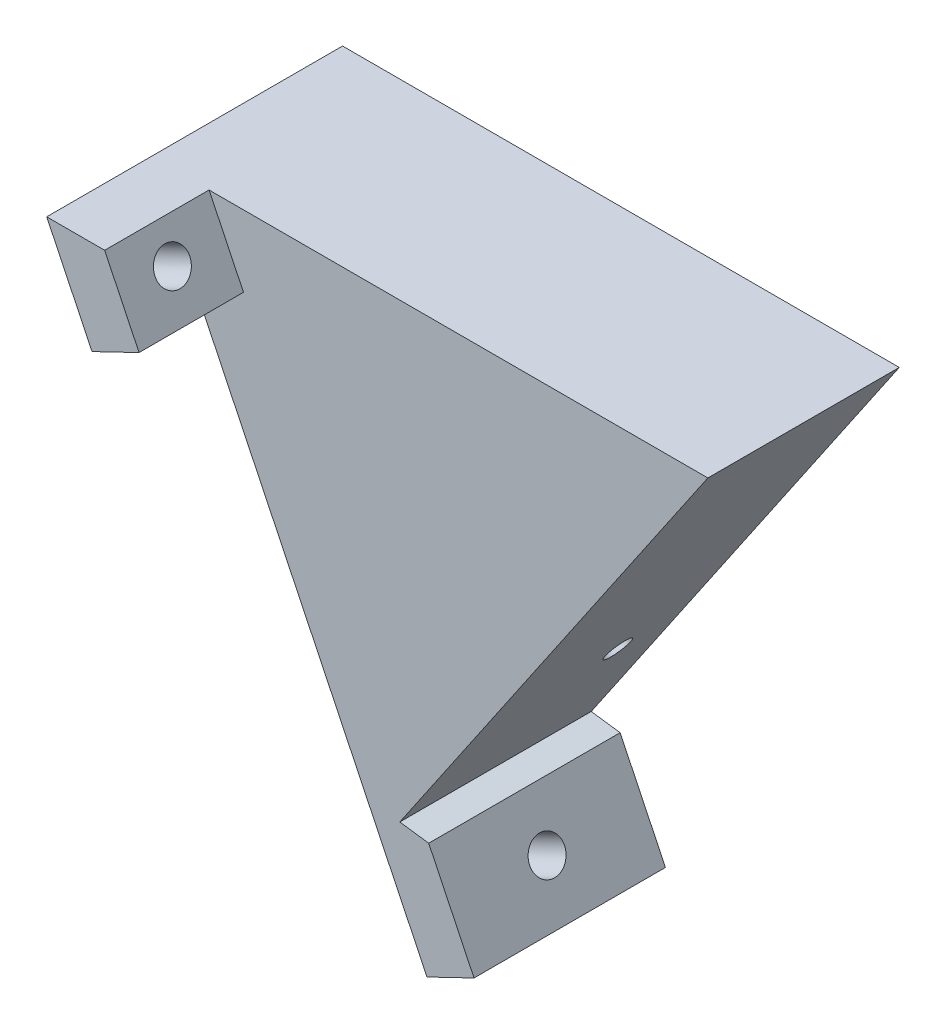
from build123d import *

# Parameters (mm, degrees)
BOSS_EXTRUDE1_DEPTH = 22
SKETCH6_W           = 12
SKETCH6_H           = 12
SKETCH6_W_2         = 22
BOSS_EXTRUDE4_DEPTH = 6
BOSS_EXTRUDE5_DEPTH = 22
SKETCH9_R           = 2
CUT_EXTRUDE9_DEPTH  = 6
SKETCH10_R          = 1.5
CUT_EXTRUDE10_DEPTH = 36
CUT_EXTRUDE11_DEPTH = 20


with BuildPart() as part:
    # Sketch1 → Boss-Extrude1 (new body)
    with BuildSketch(Plane.XY):
        Polygon((-36.238637744, 24.241346543), (-9.742760301, -30.758653457), (27.744579766, 24.241346543), align=None)
    extrude(amount=BOSS_EXTRUDE1_DEPTH)

    # Sketch6 → Boss-Extrude4 (add)
    with BuildSketch(Plane(origin=(-19.934259386, -9.603194429, 0), x_dir=(0, 0, 1), z_dir=(-0.9009094793526655, -0.4340070391278342, 0))):
        with Locations((28, 31.567082762)):
            Rectangle(SKETCH6_W, SKETCH6_H)
        with Locations((11, -29.48233592)):
            Rectangle(SKETCH6_W_2, SKETCH6_H)
    extrude(amount=-BOSS_EXTRUDE4_DEPTH)


with BuildPart() as boss_extrude4_piece_1:
    # of the separate pieces the step leaves, piece 1, a body of its own (boss_extrude4_pieces)
    add(part.part.solids().sort_by_distance((-36.238637744, 24.241346543, 0))[0])



with BuildPart() as boss_extrude4_piece_2:
    # of the separate pieces the step leaves, piece 2, a body of its own (boss_extrude4_pieces)
    add(part.part.solids().sort_by_distance((-4.337303425, -28.154611222, 0))[0])


with BuildPart() as boss_extrude4_piece_1_1:
    add(boss_extrude4_piece_1.part)

    add(boss_extrude4_piece_2.part)  # Boss-Extrude5 merges Boss-Extrude4 piece 2
    # Sketch8 → Boss-Extrude5 (add)
    with BuildSketch(Plane(origin=(0, 0, 0), x_dir=(-1, 0, 0), z_dir=(0, 0, -1))):
        Polygon((9.742760301, -30.758653457), (4.337303425, -28.154611222), (7.661322683, -27.704847324), align=None)
    extrude(amount=-BOSS_EXTRUDE5_DEPTH)

    # Sketch9 → Cut-Extrude9 (cut)
    with BuildSketch(Plane(origin=(-14.52880251, -6.999152194, 0), x_dir=(0, 0, -1), z_dir=(0.9009094793526653, 0.43400703912783434, 0))):
        with Locations(Location((-28, 30.567082762, 0), (0, 0, 90))):
            Circle(SKETCH9_R)
        with Locations(Location((-11, -29.48233592, 0), (0, 0, 90))):
            Circle(SKETCH9_R)
    extrude(amount=-CUT_EXTRUDE9_DEPTH, mode=Mode.SUBTRACT)

    # Sketch10 → Cut-Extrude10 (cut)
    with BuildSketch(Plane(origin=(7.662336774, -5.222556806, 0), x_dir=(0, 0, -1), z_dir=(0.8263158609823067, -0.5632069760656995, 0))):
        with Locations(Location((-7, -9.343049988, 0), (0, 0, 90))):
            Circle(SKETCH10_R)
    extrude(amount=-CUT_EXTRUDE10_DEPTH, mode=Mode.SUBTRACT)

    # Sketch12 → Cut-Extrude11 (cut)
    with BuildSketch(Plane(origin=(0, 0, 22), x_dir=(-1, 0, 0), z_dir=(0, 0, -1))):
        Polygon((30.833180868, 26.845388778), (29.578701161, 24.241346543), (36.238637744, 24.241346543), align=None)
    extrude(amount=-CUT_EXTRUDE11_DEPTH, mode=Mode.SUBTRACT)


solid = boss_extrude4_piece_1_1.part
